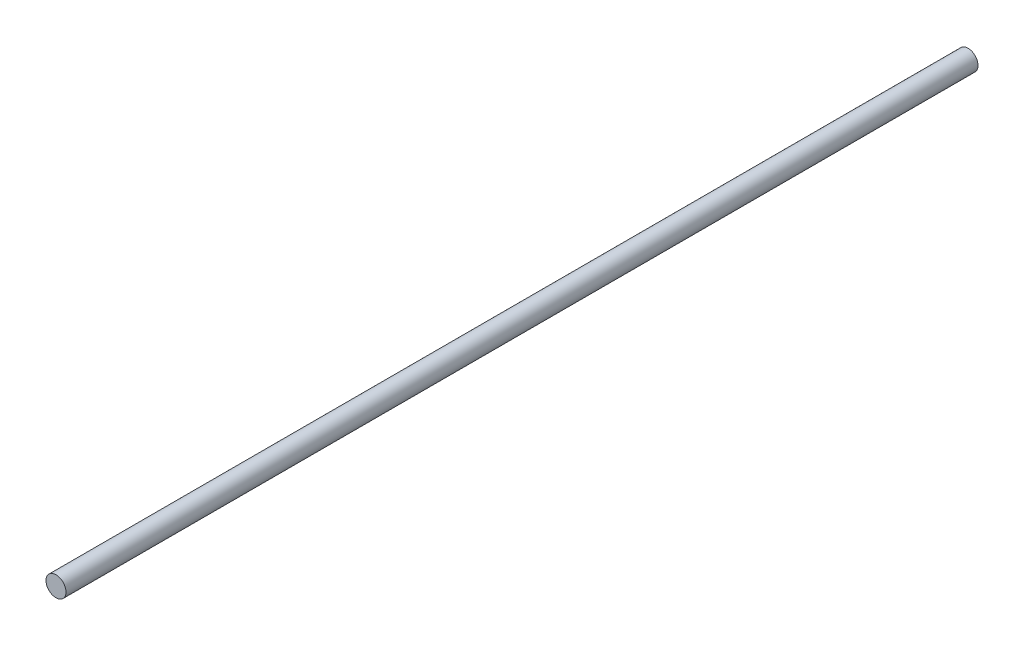
from build123d import *

# Parameters (mm, degrees)
ESQUISSE1_R        = 4
BOSS_EXTRU_1_DEPTH = 365


with BuildPart() as part:
    # Esquisse1 → Boss.-Extru.1 (new body)
    with BuildSketch(Plane.XY):
        with Locations(Location((0, 0, 0), (0, 0, 180))):
            Circle(ESQUISSE1_R)
    extrude(amount=BOSS_EXTRU_1_DEPTH)


solid = part.part
